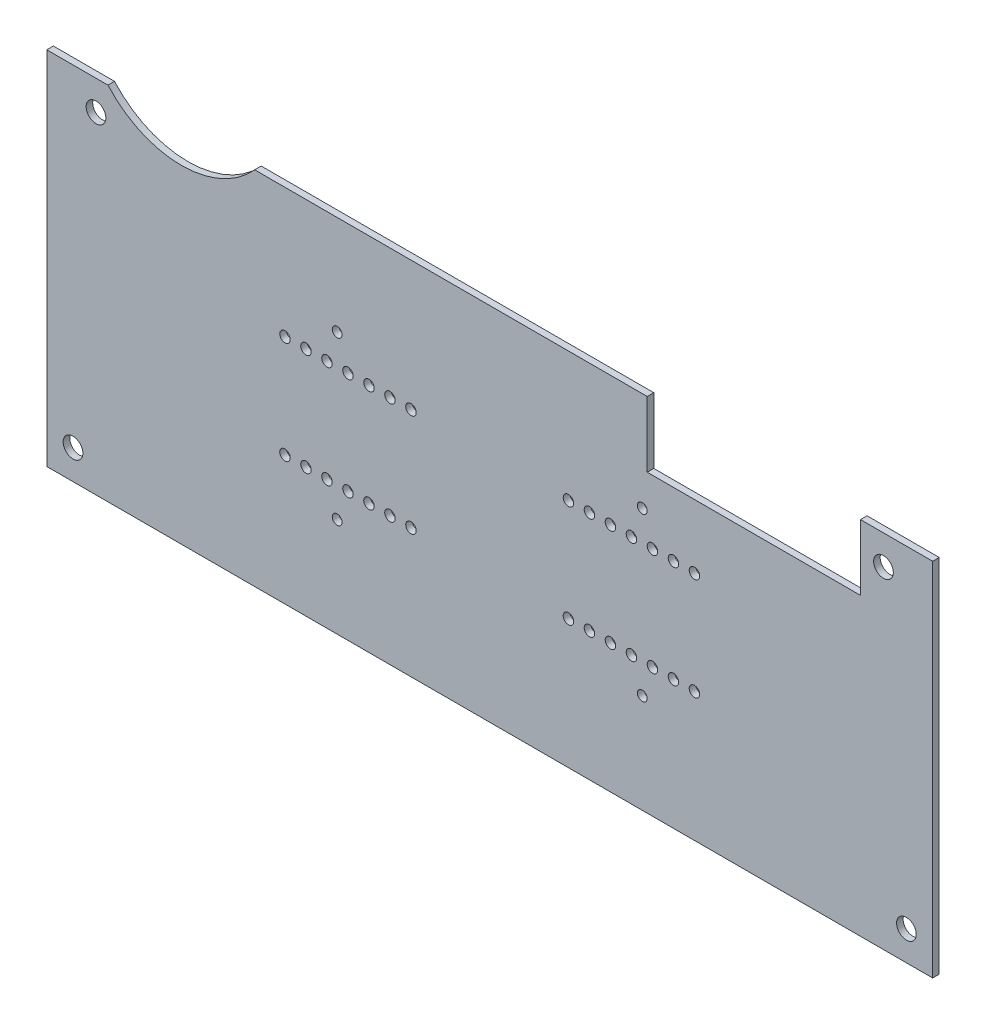
from build123d import *

# Parameters (mm, degrees)
SKETCH1_W           = 270
SKETCH1_H           = 110
BOSS_EXTRUDE1_DEPTH = 2
SKETCH5_R           = 1.5
CUT_EXTRUDE3_DEPTH  = 146.787516612
SKETCH6_R           = 1.6
CUT_EXTRUDE4_DEPTH  = 146.787516612
SKETCH7_R           = 3
CUT_EXTRUDE5_DEPTH  = 10
SKETCH8_R           = 30
SKETCH8_W           = 65
SKETCH8_H           = 20
CUT_EXTRUDE6_DEPTH  = 10


with BuildPart() as part:
    # Sketch1 → Boss-Extrude1 (new body)
    with BuildSketch(Plane.XY):
        Rectangle(SKETCH1_W, SKETCH1_H)
    extrude(amount=BOSS_EXTRUDE1_DEPTH)

    # Sketch5 → Cut-Extrude3 (cut, through all)
    with BuildSketch(Plane.XY.offset(2)):
        with Locations((-46.5, 24.75)):
            Circle(SKETCH5_R)
        with Locations((46.5, 24.75)):
            Circle(SKETCH5_R)
        with Locations((46.5, -24.75)):
            Circle(SKETCH5_R)
        with Locations((-46.5, -24.75)):
            Circle(SKETCH5_R)
    extrude(amount=-CUT_EXTRUDE3_DEPTH, mode=Mode.SUBTRACT)

    # Sketch6 → Cut-Extrude4 (cut, through all)
    with BuildSketch(Plane.XY.offset(2)):
        with Locations((-24, 15.549418684)):
            Circle(SKETCH6_R)
        with Locations((-30.4, 15.549418684)):
            Circle(SKETCH6_R)
        with Locations((-36.8, 15.549418684)):
            Circle(SKETCH6_R)
        with Locations((-43.2, 15.549418684)):
            Circle(SKETCH6_R)
        with Locations((-49.6, 15.549418684)):
            Circle(SKETCH6_R)
        with Locations((-56, 15.549418684)):
            Circle(SKETCH6_R)
        with Locations((-62.4, 15.549418684)):
            Circle(SKETCH6_R)
        with Locations((-62.4, -15.650581316)):
            Circle(SKETCH6_R)
        with Locations((-56, -15.650581316)):
            Circle(SKETCH6_R)
        with Locations((-49.6, -15.650581316)):
            Circle(SKETCH6_R)
        with Locations((-43.2, -15.650581316)):
            Circle(SKETCH6_R)
        with Locations((-36.8, -15.650581316)):
            Circle(SKETCH6_R)
        with Locations((-30.4, -15.650581316)):
            Circle(SKETCH6_R)
        with Locations((-24, -15.650581316)):
            Circle(SKETCH6_R)
        with Locations(Location((24, -15.650581316, 0), (0, 0, 180))):
            Circle(SKETCH6_R)
        with Locations(Location((30.4, -15.650581316, 0), (0, 0, 180))):
            Circle(SKETCH6_R)
        with Locations(Location((36.8, -15.650581316, 0), (0, 0, 180))):
            Circle(SKETCH6_R)
        with Locations(Location((43.2, -15.650581316, 0), (0, 0, 180))):
            Circle(SKETCH6_R)
        with Locations(Location((49.6, -15.650581316, 0), (0, 0, 180))):
            Circle(SKETCH6_R)
        with Locations(Location((56, -15.650581316, 0), (0, 0, 180))):
            Circle(SKETCH6_R)
        with Locations(Location((62.4, -15.650581316, 0), (0, 0, 180))):
            Circle(SKETCH6_R)
        with Locations(Location((62.4, 15.549418684, 0), (0, 0, 180))):
            Circle(SKETCH6_R)
        with Locations(Location((56, 15.549418684, 0), (0, 0, 180))):
            Circle(SKETCH6_R)
        with Locations(Location((49.6, 15.549418684, 0), (0, 0, 180))):
            Circle(SKETCH6_R)
        with Locations(Location((43.2, 15.549418684, 0), (0, 0, 180))):
            Circle(SKETCH6_R)
        with Locations(Location((36.8, 15.549418684, 0), (0, 0, 180))):
            Circle(SKETCH6_R)
        with Locations(Location((30.4, 15.549418684, 0), (0, 0, 180))):
            Circle(SKETCH6_R)
        with Locations(Location((24, 15.549418684, 0), (0, 0, 180))):
            Circle(SKETCH6_R)
    extrude(amount=-CUT_EXTRUDE4_DEPTH, mode=Mode.SUBTRACT)

    # Sketch7 → Cut-Extrude5 (cut)
    with BuildSketch(Plane(origin=(0, 0, 0), x_dir=(-1, 0, 0), z_dir=(0, 0, -1))):
        with Locations((-120, 46)):
            Circle(SKETCH7_R)
        with Locations((127, -46)):
            Circle(SKETCH7_R)
        with Locations((120, 46)):
            Circle(SKETCH7_R)
        with Locations((-127, -46)):
            Circle(SKETCH7_R)
    extrude(amount=-CUT_EXTRUDE5_DEPTH, mode=Mode.SUBTRACT)

    # Sketch8 → Cut-Extrude6 (cut)
    with BuildSketch(Plane(origin=(0, 0, 0), x_dir=(-1, 0, 0), z_dir=(0, 0, -1))):
        with Locations((94, 75)):
            Circle(SKETCH8_R)
        with Locations((-80.5, 45)):
            Rectangle(SKETCH8_W, SKETCH8_H)
    extrude(amount=-CUT_EXTRUDE6_DEPTH, mode=Mode.SUBTRACT)


solid = part.part
